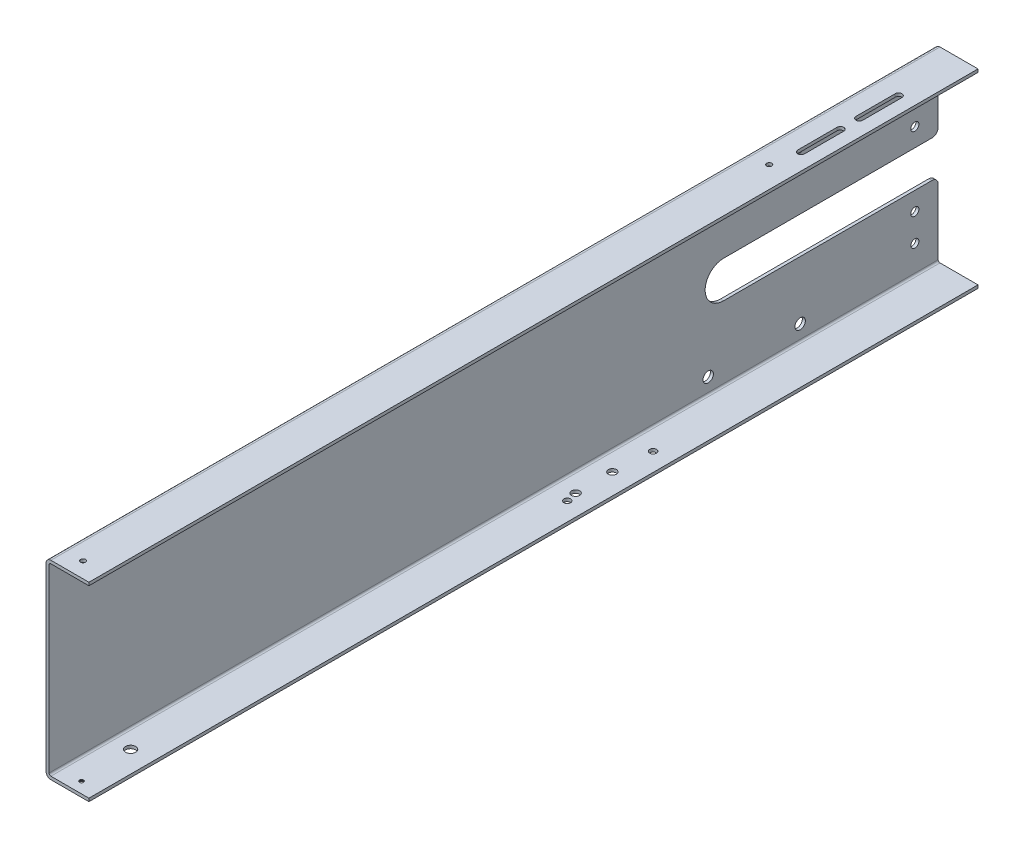
from build123d import *

# Parameters (mm, degrees)
EXTRUDE_1_DEPTH             = 1450
CUT_EXTRUDE_705_DEPTH       = 10
SKETCH_3_R                  = 8.5
CUT_EXTRUDE_1476_DEPTH      = 5
SKETCH_9_R                  = 4
CUT_EXTRUDE_2268_DEPTH      = 10
SKETCH_12_R                 = 6.6
CUT_EXTRUDE_3079_DEPTH      = 10
CUT_EXTRUDE_3564_DEPTH      = 10
SKETCH_17_R                 = 6.6
CUT_EXTRUDE_3911_DEPTH      = 10
FILLET_1_R                  = 10
SKETCH_21_R                 = 4.1
CUT_EXTRUDE_1_DEPTH         = 5
SKETCH_22_R                 = 5.5
CUT_EXTRUDE_4798_DEPTH      = 5
SKETCH_23_R                 = 8.25
CUT_EXTRUDE_5030_DEPTH      = 10
SKETCH_24_R                 = 4.1
CUT_EXTRUDE_2_DEPTH         = 10
HOLE_WIZARD_M61_D           = 6.6
HOLE_WIZARD_M61_DEPTH       = 10
HOLE_WIZARD_M61_CSINK_D     = 13.71
HOLE_WIZARD_M61_CSINK_ANGLE = 90
HOLE_WIZARD_M61_TIP         = 1.982840043


with BuildPart() as part:
    # Эскиз1 → Бобышка-Вытянуть1 (new body)
    with BuildSketch(Plane.XY):
        with BuildLine():
            Line((70, 0), (8, 0))
            ThreePointArc((8, 0), (2.343145751, 2.343145751), (0, 8))
            Line((0, 8), (0, 302))
            ThreePointArc((0, 302), (2.343145751, 307.656854249), (8, 310))
            Line((8, 310), (70, 310))
            Line((70, 310), (70, 305))
            Line((70, 305), (8, 305))
            ThreePointArc((8, 305), (5.878679656, 304.121320344), (5, 302))
            Line((5, 302), (5, 8))
            ThreePointArc((5, 8), (5.878679656, 5.878679656), (8, 5))
            Line((8, 5), (70, 5))
            Line((70, 5), (70, 0))
        make_face()
    extrude(amount=EXTRUDE_1_DEPTH)

    # Эскиз2 → Cut-Extrude 705 (cut)
    with BuildSketch(Plane.ZY):
        with BuildLine():
            Line((350, 125), (0, 125))
            Line((0, 125), (0, 185))
            Line((0, 185), (350, 185))
            ThreePointArc((350, 185), (380, 155), (350, 125))
        make_face()
    extrude(amount=-CUT_EXTRUDE_705_DEPTH, mode=Mode.SUBTRACT)

    # Эскиз3 → Cut-Extrude 1476 (cut, symmetric)
    with BuildSketch(Plane(origin=(5, 0, 0), x_dir=(0, 0, -1), z_dir=(1, 0, 0))):
        with Locations((-225, 280)):
            Circle(SKETCH_3_R)
        with Locations(Location((-225, 30, 0), (0, 0, 180))):
            Circle(SKETCH_3_R)
        with Locations(Location((-375, 280, 0), (0, 0, 180))):
            Circle(SKETCH_3_R)
        with Locations((-375, 30)):
            Circle(SKETCH_3_R)
    extrude(amount=CUT_EXTRUDE_1476_DEPTH, both=True, mode=Mode.SUBTRACT)

    # Эскиз9 → Cut-Extrude 2268 (cut)
    with BuildSketch(Plane.ZY):
        with Locations(Location((740, 260, 0), (0, 0, 270))):
            Circle(SKETCH_9_R)
        with Locations(Location((980, 260, 0), (0, 0, 270))):
            Circle(SKETCH_9_R)
        with BuildLine():
            Line((778, 240), (942, 240))
            ThreePointArc((942, 240), (954.727922061, 245.272077939), (960, 258))
            Line((960, 258), (960, 262))
            ThreePointArc((960, 262), (954.727922061, 274.727922061), (942, 280))
            Line((942, 280), (778, 280))
            ThreePointArc((778, 280), (765.272077939, 274.727922061), (760, 262))
            Line((760, 262), (760, 258))
            ThreePointArc((760, 258), (765.272077939, 245.272077939), (778, 240))
        make_face()
    extrude(amount=-CUT_EXTRUDE_2268_DEPTH, mode=Mode.SUBTRACT)

    # Эскиз12 → Cut-Extrude 3079 (cut)
    with BuildSketch(Plane.ZY):
        with Locations(Location((38, 215, 0), (0, 0, 270))):
            Circle(SKETCH_12_R)
        with Locations(Location((38, 260, 0), (0, 0, 270))):
            Circle(SKETCH_12_R)
        with Locations((38, 95)):
            Circle(SKETCH_12_R)
        with Locations((38, 50)):
            Circle(SKETCH_12_R)
    extrude(amount=-CUT_EXTRUDE_3079_DEPTH, mode=Mode.SUBTRACT)

    # Эскиз13 → Cut-Extrude 3564 (cut)
    with BuildSketch(Plane(origin=(0, 310, 0), x_dir=(1, 0, 0), z_dir=(0, 1, 0))):
        with BuildLine():
            Line((37.5, -166.5), (37.5, -102.5))
            ThreePointArc((37.5, -102.5), (43, -97), (48.5, -102.5))
            Line((48.5, -102.5), (48.5, -166.5))
            ThreePointArc((48.5, -166.5), (43, -172), (37.5, -166.5))
        make_face()
        with BuildLine():
            Line((37.5, -261.5), (37.5, -197.5))
            ThreePointArc((37.5, -197.5), (43, -192), (48.5, -197.5))
            Line((48.5, -197.5), (48.5, -261.5))
            ThreePointArc((48.5, -261.5), (43, -267), (37.5, -261.5))
        make_face()
    extrude(amount=-CUT_EXTRUDE_3564_DEPTH, mode=Mode.SUBTRACT)

    # Эскиз17 → Cut-Extrude 3911 (cut)
    with BuildSketch(Plane(origin=(0, 0, 0), x_dir=(-1, 0, 0), z_dir=(0, -1, 0))):
        with Locations(Location((-36, -562.3, 0), (0, 0, 180))):
            Circle(SKETCH_17_R)
        with Locations(Location((-36, -622.3, 0), (0, 0, 180))):
            Circle(SKETCH_17_R)
    extrude(amount=-CUT_EXTRUDE_3911_DEPTH, mode=Mode.SUBTRACT)

    # Скругление1
    fillet_1_edges = [part.edges().sort_by_distance(p)[0] for p in [
        (2.5, 185, 0),
        (2.5, 125, 0),
    ]]
    fillet(fillet_1_edges, radius=FILLET_1_R)

    # Эскиз21 → Отверстия крепления крышки 1 (cut)
    with BuildSketch(Plane(origin=(0, 310, 0), x_dir=(1, 0, 0), z_dir=(0, 1, 0))):
        with Locations(Location((35, -305.5, 0), (0, 0, 270))):
            Circle(SKETCH_21_R)
    extrude(amount=-CUT_EXTRUDE_1_DEPTH, mode=Mode.SUBTRACT)

    # Эскиз22 → Cut-Extrude 4798 (cut)
    with BuildSketch(Plane.XZ):
        with Locations((40.0885, 500)):
            Circle(SKETCH_22_R)
        with Locations((40.0885, 640)):
            Circle(SKETCH_22_R)
    extrude(amount=-CUT_EXTRUDE_4798_DEPTH, mode=Mode.SUBTRACT)

    # Эскиз23 → Cut-Extrude 5030 (cut)
    with BuildSketch(Plane.XZ):
        with Locations((35, 1347)):
            Circle(SKETCH_23_R)
    extrude(amount=-CUT_EXTRUDE_5030_DEPTH, mode=Mode.SUBTRACT)

    # Эскиз24 → Отверстие крепления крышки 2 (cut)
    with BuildSketch(Plane(origin=(0, 310, 0), x_dir=(1, 0, 0), z_dir=(0, 1, 0))):
        with Locations(Location((35, -1424.5, 0), (0, 0, 270))):
            Circle(SKETCH_24_R)
    extrude(amount=-CUT_EXTRUDE_2_DEPTH, mode=Mode.SUBTRACT)

    # Зенковка для винта с потайной головкой и внутренним шестигранником M61
    with Locations(Plane.XZ):
        with Locations((40, 1432)):
            CounterSinkHole(HOLE_WIZARD_M61_D / 2, HOLE_WIZARD_M61_CSINK_D / 2, depth=HOLE_WIZARD_M61_DEPTH, counter_sink_angle=HOLE_WIZARD_M61_CSINK_ANGLE)
            with Locations((0, 0, -(HOLE_WIZARD_M61_DEPTH + HOLE_WIZARD_M61_TIP / 2))):  # 118° drill point
                Cone(0, HOLE_WIZARD_M61_D / 2, HOLE_WIZARD_M61_TIP, mode=Mode.SUBTRACT)


solid = part.part
